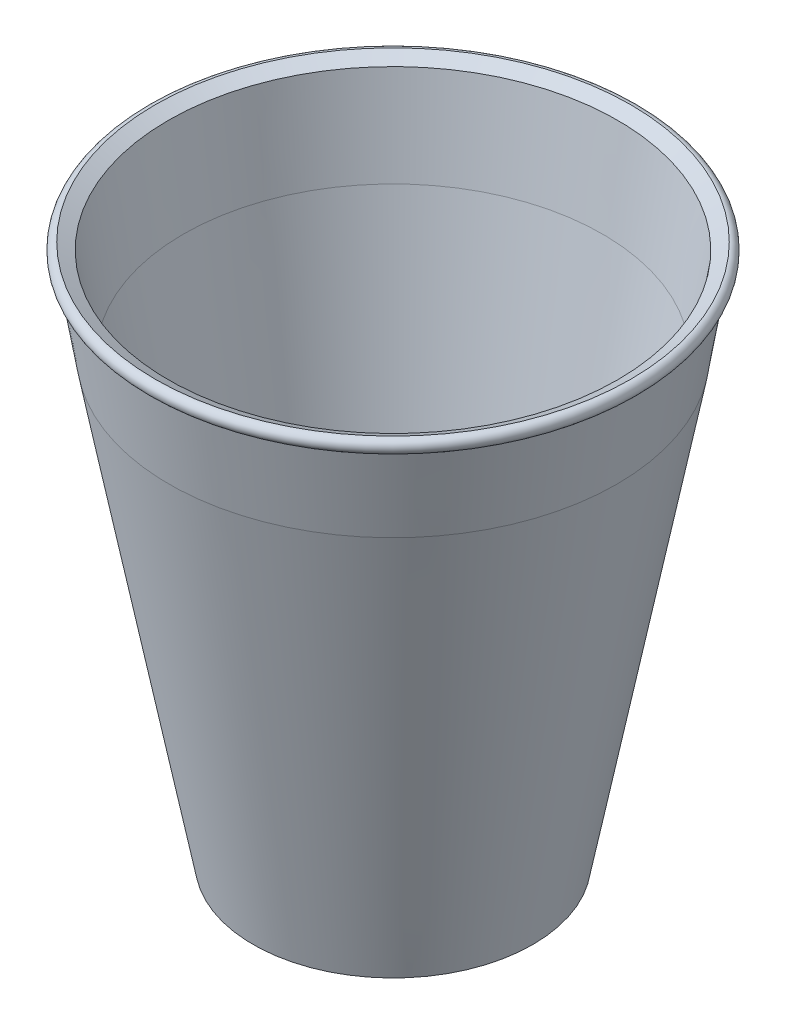
from build123d import *


with BuildPart() as part:
    # Sketch1 → Revolve1 (revolve)
    with BuildSketch(Plane.XY):
        with BuildLine():
            Line((-32.130708731, -1), (-34, 0))
            ThreePointArc((-34, 0), (-35, -1), (-34, -2))
            Line((-34, -2), (-32, -14))
            Line((-32, -14), (-20, -77))
            Line((-20, -77), (-12.6, -77))
            Line((-12.6, -77), (-12.322608601, -76.778086881))
            ThreePointArc((-12.322608601, -76.778086881), (-12.290715274, -76.666899306), (-12.385078106, -76.6))
            Line((-12.385078106, -76.6), (-12.6, -76.6))
            Line((-12.6, -76.6), (-12.6, -75.2))
            Line((-12.6, -75.2), (0, -75.2))
            Line((0, -75.2), (0, -73.7))
            Line((0, -73.7), (-18.592613493, -73.7))
            Line((-18.592613493, -73.7), (-29.964042064, -14))
            Line((-29.964042064, -14), (-32.130708731, -1))
        make_face()
    revolve(axis=Axis((0, 0, 0), (0, -1, 0)))


solid = part.part
